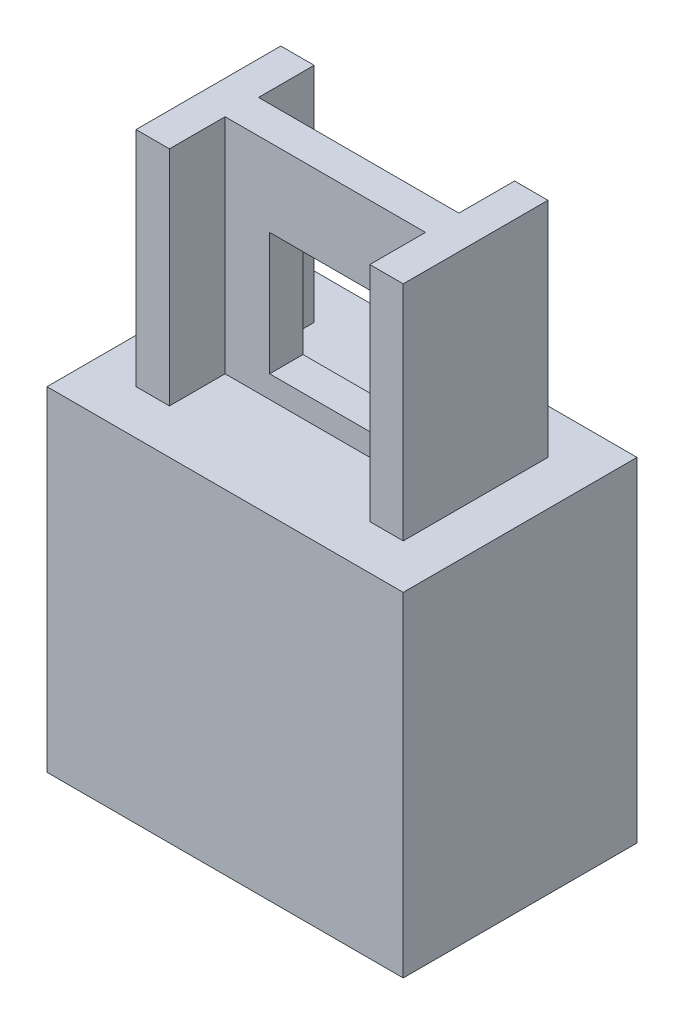
from build123d import *

# Parameters (mm, degrees)
SKETCH1_W               = 12
SKETCH1_H               = 6.5
BOSS_EXTRUDE1_DEPTH     = 10
SKETCH2_W               = 16
SKETCH2_H               = 10.5
BOSS_EXTRUDE2_DEPTH     = 15
SKETCH3_W               = 9
SKETCH3_H               = 2.5
CUT_EXTRUDE1_DEPTH      = 10
CUT_EXTRUDE2_DEPTH      = 19.027756377
CUT_EXTRUDE2_DEPTH_BACK = 19.027756377
SKETCH4_W               = 5
SKETCH4_H               = 5.5


with BuildPart() as part:
    # Sketch1 → Boss-Extrude1 (new body)
    with BuildSketch(Plane(origin=(0, 0, 0), x_dir=(1, 0, 0), z_dir=(0, 1, 0))):
        Rectangle(SKETCH1_W, SKETCH1_H)
    extrude(amount=BOSS_EXTRUDE1_DEPTH)

    # Sketch2 → Boss-Extrude2 (add)
    with BuildSketch(Plane(origin=(0, 0, 0), x_dir=(1, 0, 0), z_dir=(0, 1, 0))):
        Rectangle(SKETCH2_W, SKETCH2_H)
    extrude(amount=-BOSS_EXTRUDE2_DEPTH)

    # Sketch3 → Cut-Extrude1 (cut)
    with BuildSketch(Plane(origin=(0, 10, 0), x_dir=(1, 0, 0), z_dir=(0, 1, 0))):
        with Locations((0, 2)):
            Rectangle(SKETCH3_W, SKETCH3_H)
        with Locations((0, -2)):
            Rectangle(SKETCH3_W, SKETCH3_H)
    extrude(amount=-CUT_EXTRUDE1_DEPTH, mode=Mode.SUBTRACT)

    # Sketch4 → Cut-Extrude2 (cut, two sides: drawn at the far end of the back side and taken through both)
    with BuildSketch(Plane(origin=(0, 0, -0.75), x_dir=(-1, 0, 0), z_dir=(0, 0, -1)).offset(-CUT_EXTRUDE2_DEPTH_BACK)):
        with Locations((0, 3.75)):
            Rectangle(SKETCH4_W, SKETCH4_H)
    extrude(amount=CUT_EXTRUDE2_DEPTH + CUT_EXTRUDE2_DEPTH_BACK, mode=Mode.SUBTRACT)


solid = part.part
